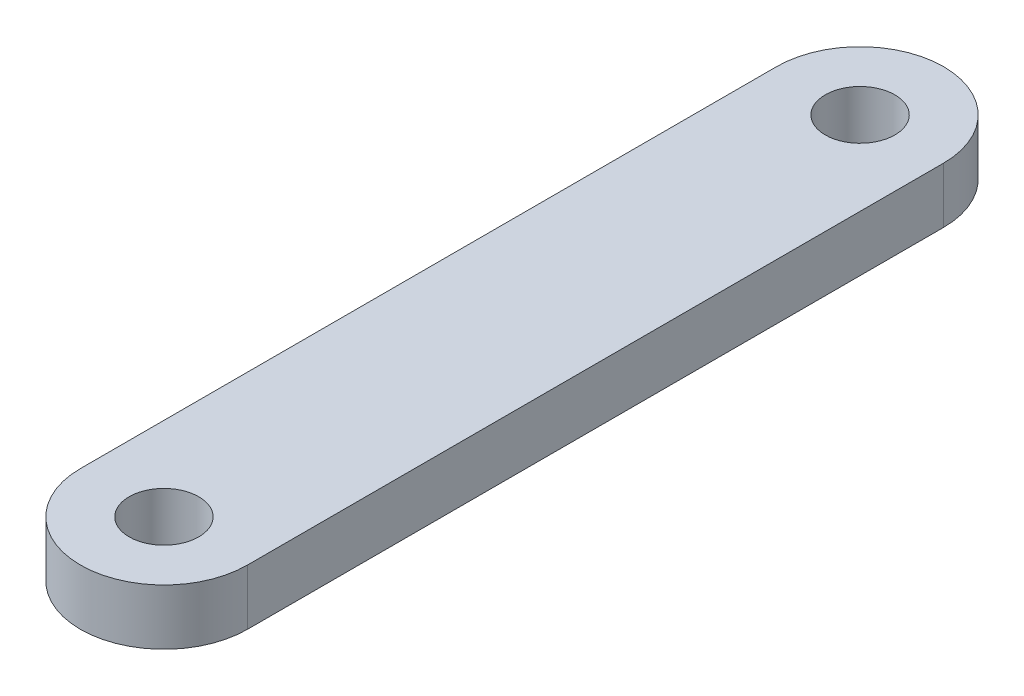
from build123d import *

# Parameters (mm, degrees)
SKETCH_1_R      = 5
EXTRUDE_1_DEPTH = 8


with BuildPart() as part:
    # ｽｹｯﾁ1 → ﾎﾞｽ - 押し出し1 (new body)
    with BuildSketch(Plane(origin=(0, 0, 0), x_dir=(1, 0, 0), z_dir=(0, 1, 0))):
        with BuildLine():
            Line((-12, 0), (-12, 100))
            ThreePointArc((-12, 100), (0, 112), (12, 100))
            Line((12, 100), (12, 0))
            ThreePointArc((12, 0), (0, -12), (-12, 0))
        make_face()
        with Locations(Location((0, 0, 0), (0, 0, 270))):
            Circle(SKETCH_1_R, mode=Mode.SUBTRACT)
        with Locations(Location((0, 100, 0), (0, 0, 270))):
            Circle(SKETCH_1_R, mode=Mode.SUBTRACT)
    extrude(amount=EXTRUDE_1_DEPTH)


solid = part.part
